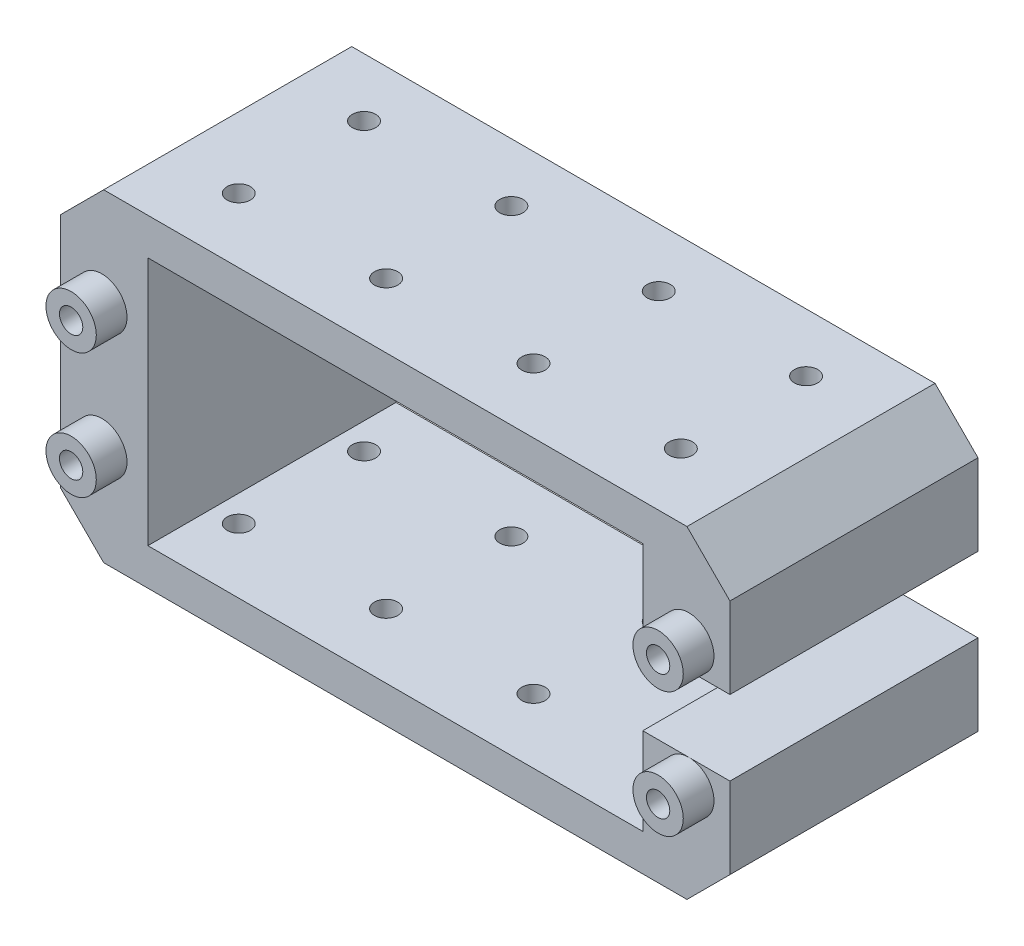
from build123d import *

# Parameters (mm, degrees)
SKETCH_1_W          = 54.5
SKETCH_1_H          = 26.3
SKETCH_1_R          = 0.95
SKETCH_1_W_2        = 40.3
SKETCH_1_H_2        = 20.3
EXTRUDE_1_DEPTH     = 20.2
SKETCH_2_R          = 2.05
SKETCH_2_R_2        = 0.95
EXTRUDE_2_DEPTH     = 2.5
CHAMFER_1_SIZE      = 3.5
SKETCH_3_R          = 0.95
CUT_EXTRUDE_1_DEPTH = 45.15362386
SKETCH_4_R          = 0.95
CUT_EXTRUDE_2_DEPTH = 45.15362386
SKETCH_5_W          = 7.1
SKETCH_5_H          = 6.1
CUT_EXTRUDE_3_DEPTH = 37.380283121


with BuildPart() as part:
    # 스케치1 → 보스-돌출1 (new body)
    with BuildSketch(Plane.XY):
        Rectangle(SKETCH_1_W, SKETCH_1_H)
        with Locations((-23.9, 5.1)):
            Circle(SKETCH_1_R, mode=Mode.SUBTRACT)
        with Locations((23.9, 5.1)):
            Circle(SKETCH_1_R, mode=Mode.SUBTRACT)
        with Locations((23.9, -5.1)):
            Circle(SKETCH_1_R, mode=Mode.SUBTRACT)
        with Locations((-23.9, -5.1)):
            Circle(SKETCH_1_R, mode=Mode.SUBTRACT)
        Rectangle(SKETCH_1_W_2, SKETCH_1_H_2, mode=Mode.SUBTRACT)
    extrude(amount=EXTRUDE_1_DEPTH)

    # 스케치2 → 보스-돌출2 (add)
    # profile 1 of 4: a face of its own
    with BuildSketch(Plane.XY.offset(20.2)):
        with Locations((-23.9, 5.1)):
            Circle(SKETCH_2_R)
        with Locations((-23.9, 5.1)):
            Circle(SKETCH_2_R_2, mode=Mode.SUBTRACT)
    # profile 2 of 4: a face of its own
    with BuildSketch(Plane.XY.offset(20.2)):
        with Locations((-23.9, -5.1)):
            Circle(SKETCH_2_R)
        with Locations((-23.9, -5.1)):
            Circle(SKETCH_2_R_2, mode=Mode.SUBTRACT)
    # profile 3 of 4: a face of its own
    with BuildSketch(Plane.XY.offset(20.2)):
        with Locations((23.9, 5.1)):
            Circle(SKETCH_2_R)
        with Locations((23.9, 5.1)):
            Circle(SKETCH_2_R_2, mode=Mode.SUBTRACT)
    # profile 4 of 4: a face of its own
    with BuildSketch(Plane.XY.offset(20.2)):
        with Locations((23.9, -5.1)):
            Circle(SKETCH_2_R)
        with Locations((23.9, -5.1)):
            Circle(SKETCH_2_R_2, mode=Mode.SUBTRACT)
    extrude(amount=EXTRUDE_2_DEPTH)

    # 모따기1
    chamfer_1_edges = [part.edges().sort_by_distance(p)[0] for p in [
        (27.25, 13.15, 10.1),
        (27.25, -13.15, 10.1),
        (-27.25, -13.15, 10.1),
        (-27.25, 13.15, 10.1),
    ]]
    chamfer(chamfer_1_edges, length=CHAMFER_1_SIZE)

    # 스케치3 → 컷-돌출1 (cut, through all)
    with BuildSketch(Plane.XZ.offset(13.15)):
        with Locations(Location((-6, 14.95, 0), (0, 0, 270))):
            Circle(SKETCH_3_R)
        with Locations(Location((6, 14.95, 0), (0, 0, 270))):
            Circle(SKETCH_3_R)
        with Locations(Location((-18, 14.95, 0), (0, 0, 270))):
            Circle(SKETCH_3_R)
        with Locations(Location((18, 14.95, 0), (0, 0, 270))):
            Circle(SKETCH_3_R)
    extrude(amount=-CUT_EXTRUDE_1_DEPTH, mode=Mode.SUBTRACT)

    # 스케치4 → 컷-돌출2 (cut, through all)
    with BuildSketch(Plane.XZ.offset(13.15)):
        with Locations(Location((-6, 4.75, 0), (0, 0, 270))):
            Circle(SKETCH_4_R)
        with Locations(Location((6, 4.75, 0), (0, 0, 270))):
            Circle(SKETCH_4_R)
        with Locations(Location((-18, 4.75, 0), (0, 0, 270))):
            Circle(SKETCH_4_R)
        with Locations(Location((18, 4.75, 0), (0, 0, 270))):
            Circle(SKETCH_4_R)
    extrude(amount=-CUT_EXTRUDE_2_DEPTH, mode=Mode.SUBTRACT)

    # 스케치5 → 컷-돌출3 (cut, through all)
    with BuildSketch(Plane.XY.offset(20.2)):
        with Locations((23.7, 0)):
            Rectangle(SKETCH_5_W, SKETCH_5_H)
    extrude(amount=-CUT_EXTRUDE_3_DEPTH, mode=Mode.SUBTRACT)


solid = part.part
